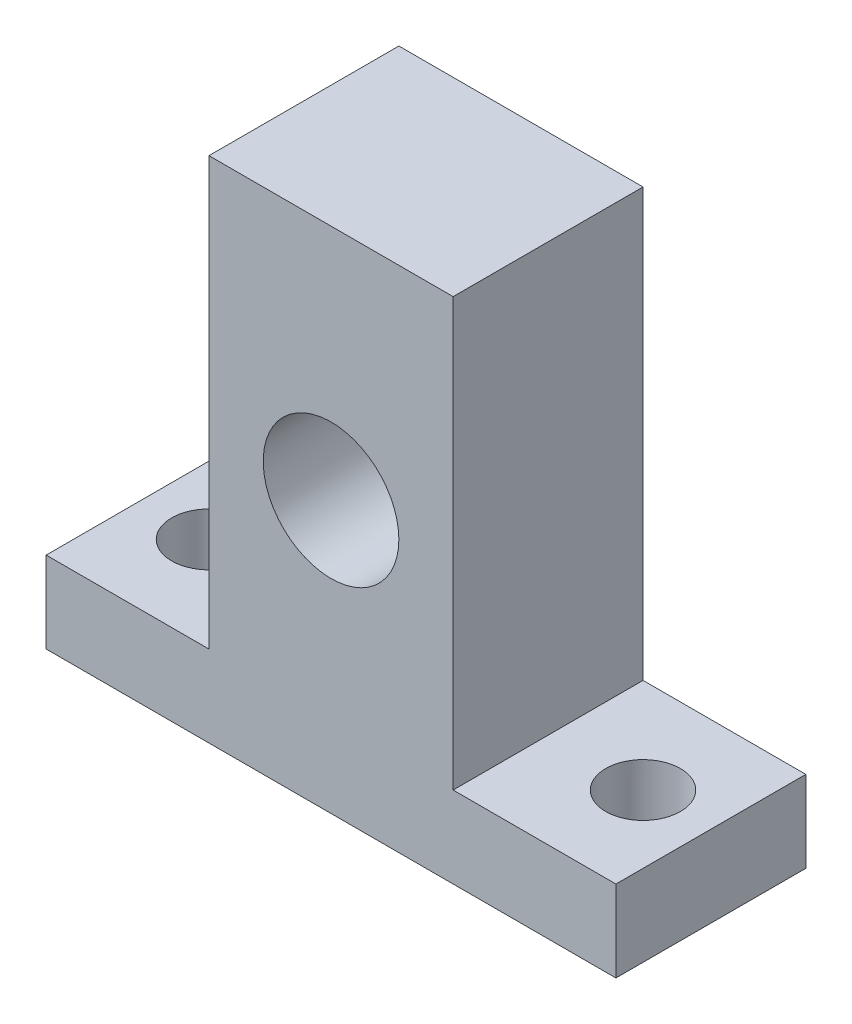
from build123d import *

# Parameters (mm, degrees)
SKETCH1_R           = 5
BOSS_EXTRUDE1_DEPTH = 14
SKETCH2_R           = 2.75
CUT_EXTRUDE1_DEPTH  = 46.202322949


with BuildPart() as part:
    # Sketch1 → Boss-Extrude1 (new body)
    with BuildSketch(Plane.XY):
        Polygon((-9, 37.5), (9, 37.5), (9, 6), (21, 6), (21, 0), (-21, 0), (-21, 6), (-9, 6), align=None)
        with Locations((0, 20)):
            Circle(SKETCH1_R, mode=Mode.SUBTRACT)
    extrude(amount=BOSS_EXTRUDE1_DEPTH)

    # Sketch2 → Cut-Extrude1 (cut, through all)
    with BuildSketch(Plane.XZ):
        with Locations((-16, 7)):
            Circle(SKETCH2_R)
        with Locations((16, 7)):
            Circle(SKETCH2_R)
    extrude(amount=-CUT_EXTRUDE1_DEPTH, mode=Mode.SUBTRACT)


solid = part.part
